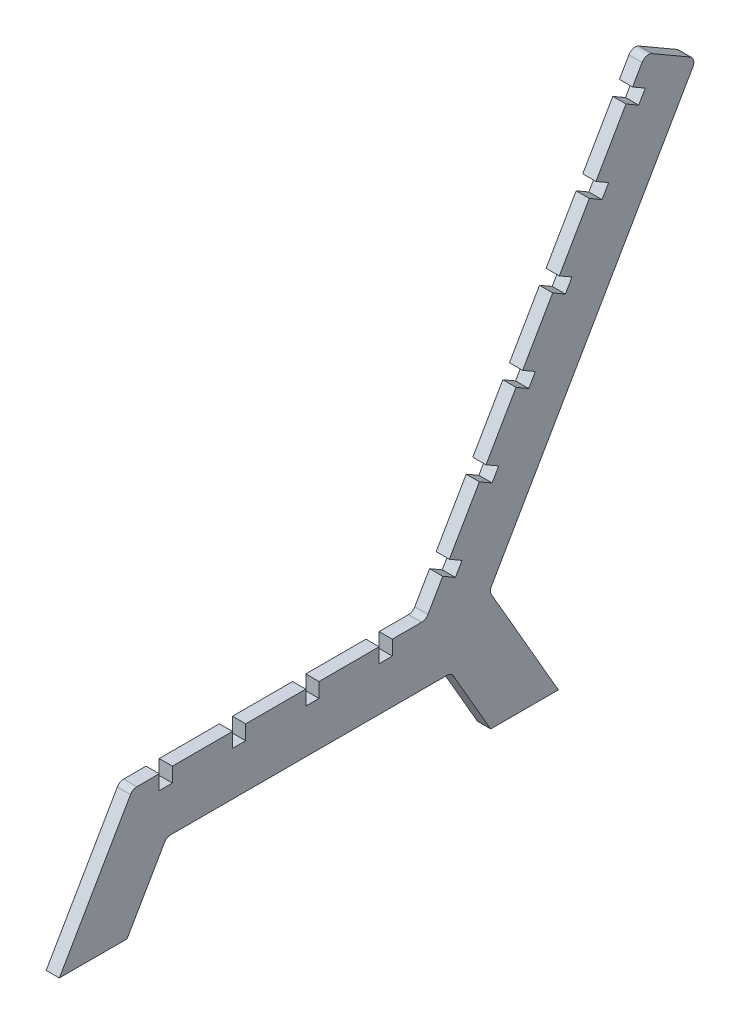
from build123d import *

# Parameters (mm, degrees)
ESTRUSIONE_ESTRUSIONE1_DEPTH = 18
RACCORDO1_R                  = 10
RACCORDO2_R                  = 10


with BuildPart() as part:
    # Schizzo1 → Estrusione-Estrusione1 (new body)
    with BuildSketch(Plane(origin=(0, 0, 0), x_dir=(0, 0, -1), z_dir=(1, 0, 0))):
        Polygon((-109.503770047, 350), (-109.503770047, 330), (-127.503770047, 330), (-127.503770047, 350), (-209.503770047, 350), (-209.503770047, 330), (-227.503770047, 330), (-227.503770047, 350), (-309.503770047, 350), (-309.503770047, 330), (-327.503770047, 330), (-327.503770047, 350), (-363.727557783, 350), (-463.727557783, 176.794919243), (-371.351514713, 176.794919243), (-317.539536248, 270), (70.913458368, 270), (124.725436833, 176.794919243), (217.101479903, 176.794919243), (122.874982595, 340), (405.554474519, 829.615242271), (336.272442217, 869.615242271), (318.31248319, 838.507680735), (335.632991266, 828.507680735), (326.632991266, 812.919223467), (309.31248319, 822.919223467), (268.31248319, 751.905140356), (285.632991266, 741.905140356), (276.632991266, 726.316683088), (259.31248319, 736.316683088), (218.31248319, 665.302599978), (235.632991266, 655.302599978), (226.632991266, 639.71414271), (209.31248319, 649.71414271), (168.31248319, 578.7000596), (185.632991266, 568.7000596), (176.632991266, 553.111602331), (159.31248319, 563.111602331), (118.31248319, 492.097519221), (135.632991266, 482.097519221), (126.632991266, 466.509061953), (109.31248319, 476.509061953), (68.31248319, 405.494978843), (85.632991266, 395.494978843), (76.632991266, 379.906521574), (59.31248319, 389.906521574), (36.272442217, 350), (-9.503770047, 350), (-9.503770047, 330), (-27.503770047, 330), (-27.503770047, 350), align=None)
    extrude(amount=ESTRUSIONE_ESTRUSIONE1_DEPTH)

    # Raccordo1
    raccordo1_edges = [part.edges().sort_by_distance(p)[0] for p in [
        (9, 350, -36.272442217),
    ]]
    fillet(raccordo1_edges, radius=RACCORDO1_R)

    # Raccordo2
    raccordo2_edges = [part.edges().sort_by_distance(p)[0] for p in [
        (9, 869.615242271, -336.272442217),
        (9, 829.615242271, -405.554474519),
        (9, 340, -122.874982595),
        (9, 270, -70.913458368),
        (9, 270, 317.539536248),
        (9, 350, 363.727557783),
    ]]
    fillet(raccordo2_edges, radius=RACCORDO2_R)


solid = part.part
